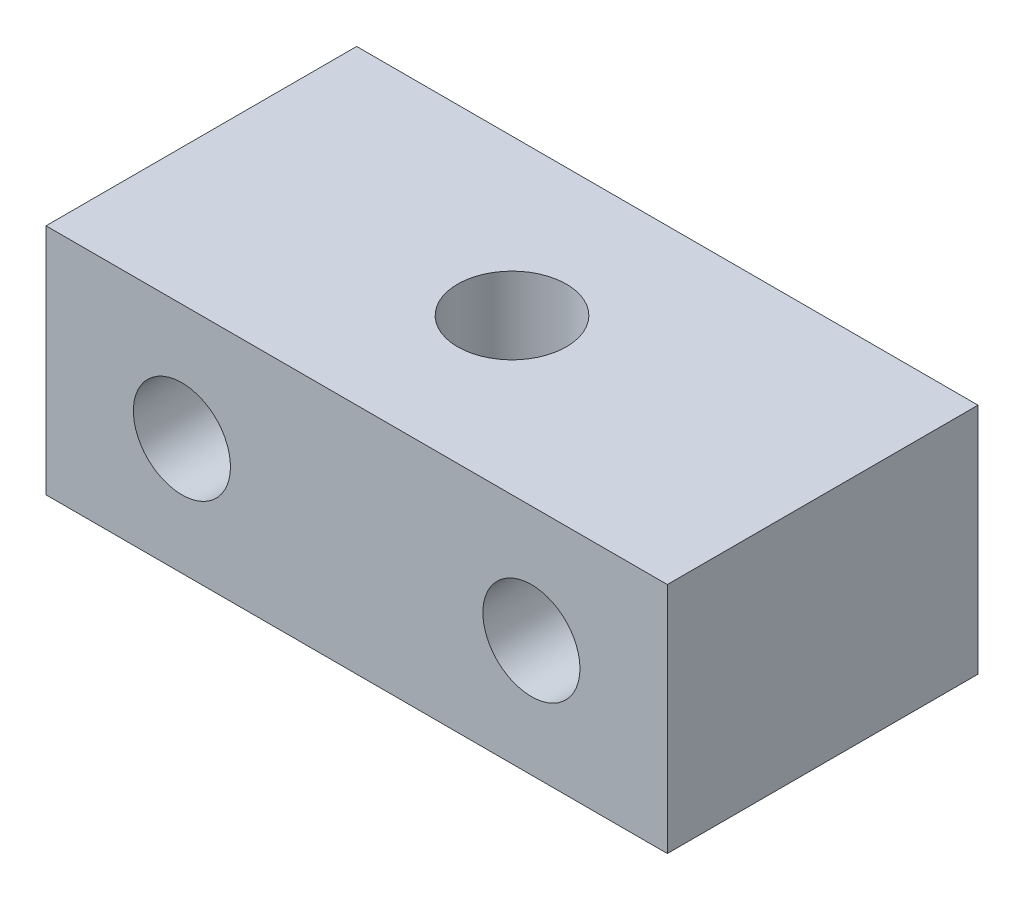
from build123d import *

# Parameters (mm, degrees)
SKETCH1_W           = 50.8
SKETCH1_H           = 19.05
SKETCH1_R           = 3.96875
BOSS_EXTRUDE2_DEPTH = 12.7
SKETCH2_R           = 4.445
CUT_EXTRUDE1_DEPTH  = 94.3255592


with BuildPart() as part:
    # Sketch1 → Boss-Extrude2 (new, symmetric)
    with BuildSketch(Plane.XY):
        with Locations((0, 79.375)):
            Rectangle(SKETCH1_W, SKETCH1_H)
        with Locations((-14.2875, 79.375)):
            Circle(SKETCH1_R, mode=Mode.SUBTRACT)
        with Locations((14.2875, 79.375)):
            Circle(SKETCH1_R, mode=Mode.SUBTRACT)
    extrude(amount=BOSS_EXTRUDE2_DEPTH, both=True)

    # Sketch2 → Cut-Extrude1 (cut, through all)
    with BuildSketch(Plane(origin=(0, 0, 0), x_dir=(1, 0, 0), z_dir=(0, 1, 0))):
        with Locations(Location((0, 0, 0), (0, 0, 270))):
            Circle(SKETCH2_R)
    extrude(amount=CUT_EXTRUDE1_DEPTH, mode=Mode.SUBTRACT)


solid = part.part
